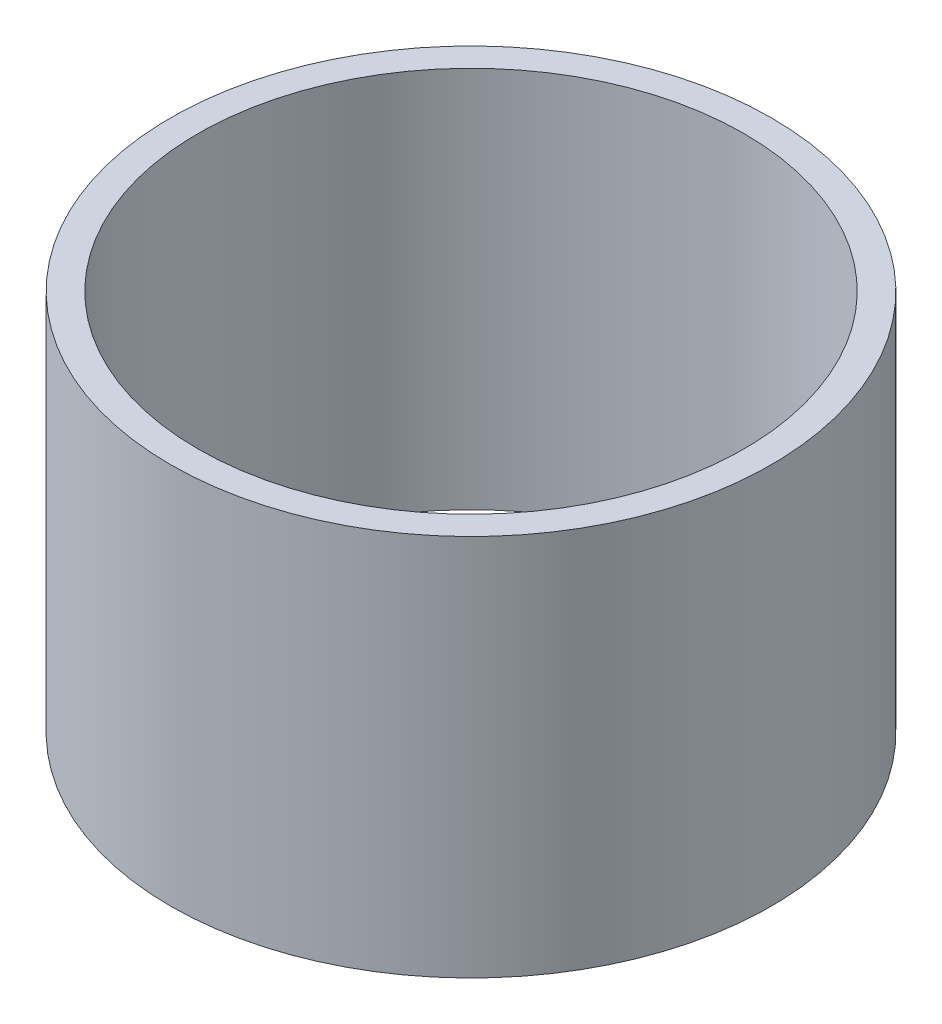
from build123d import *

# Parameters (mm, degrees)
SKETCH1_R           = 69.85
SKETCH1_R_2         = 63.5
BOSS_EXTRUDE1_DEPTH = 88.9


with BuildPart() as part:
    # Sketch1 → Boss-Extrude1 (new body)
    with BuildSketch(Plane(origin=(0, 0, 0), x_dir=(1, 0, 0), z_dir=(0, 1, 0))):
        with Locations(Location((0, 0, 0), (0, 0, 270))):
            Circle(SKETCH1_R)
        with Locations(Location((0, 0, 0), (0, 0, 270))):
            Circle(SKETCH1_R_2, mode=Mode.SUBTRACT)
    extrude(amount=BOSS_EXTRUDE1_DEPTH)


solid = part.part
